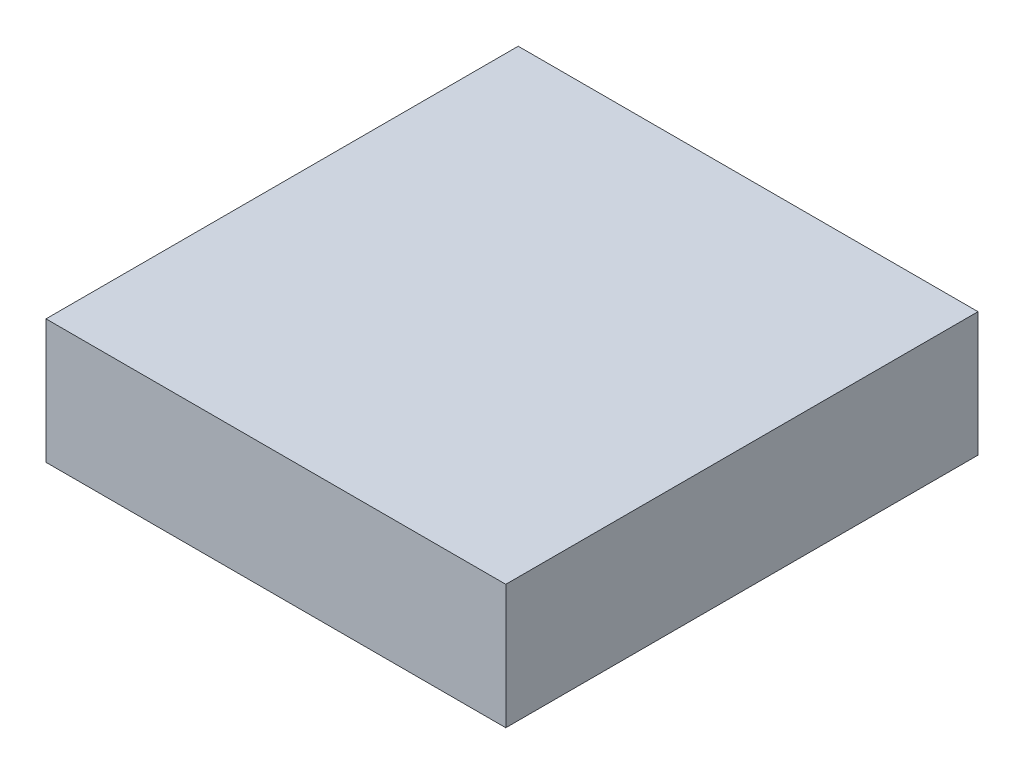
from build123d import *

# Parameters (mm, degrees)
BOSS_EXTRUDE1_DEPTH = 10


with BuildPart() as part:
    # Sketch1 → Boss-Extrude1 (new body)
    with BuildSketch(Plane(origin=(0, 0, 0), x_dir=(1, 0, 0), z_dir=(0, 1, 0))):
        Polygon((-18.5, 19), (18.5, 19), (18.5, -19), (-18.5, -19), (-18.5, -3), (-18.5, 3), align=None)
    extrude(amount=BOSS_EXTRUDE1_DEPTH)


solid = part.part
